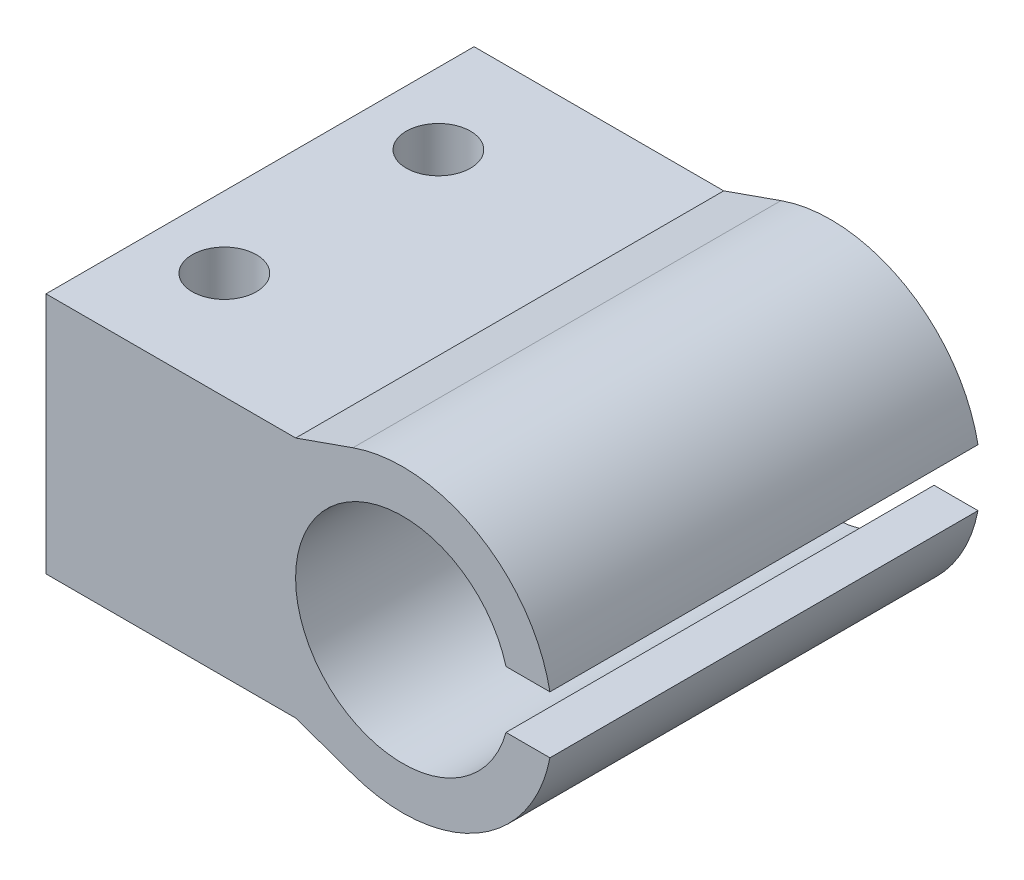
from build123d import *

# Parameters (mm, degrees)
EXTRUDE_1_DEPTH     = 30
SKETCH_3_R          = 2.25
CUT_EXTRUDE_1_DEPTH = 44.431774142


with BuildPart() as part:
    # 草图2 → 凸台-拉伸1 (new body)
    with BuildSketch(Plane.XY):
        with BuildLine():
            Line((-25, 8.5), (-7.5, 8.5))
            Line((-7.5, 8.5), (-3.489994595, 9.911925219))
            ThreePointArc((-3.489994595, 9.911925219), (5.22487297, 9.117402386), (10.31631348, 2))
            Line((10.31631348, 2), (7.237124133, 2))
            ThreePointArc((7.237124133, 2), (-7.508393018, 0), (7.237124133, -2))
            Line((7.237124133, -2), (10.31631348, -2))
            ThreePointArc((10.31631348, -2), (5.22487297, -9.117402386), (-3.489994595, -9.911925219))
            Line((-3.489994595, -9.911925219), (-7.5, -8.5))
            Line((-7.5, -8.5), (-25, -8.5))
            Line((-25, -8.5), (-25, 8.5))
        make_face()
    extrude(amount=EXTRUDE_1_DEPTH)

    # 草图3 → 切除-拉伸1 (cut, through all)
    with BuildSketch(Plane.XZ.offset(8.5)):
        with Locations(Location((-20, 7.5, 0), (0, 0, 270))):
            Circle(SKETCH_3_R)
        with Locations(Location((-20, 22.5, 0), (0, 0, 270))):
            Circle(SKETCH_3_R)
    extrude(amount=-CUT_EXTRUDE_1_DEPTH, mode=Mode.SUBTRACT)


solid = part.part
